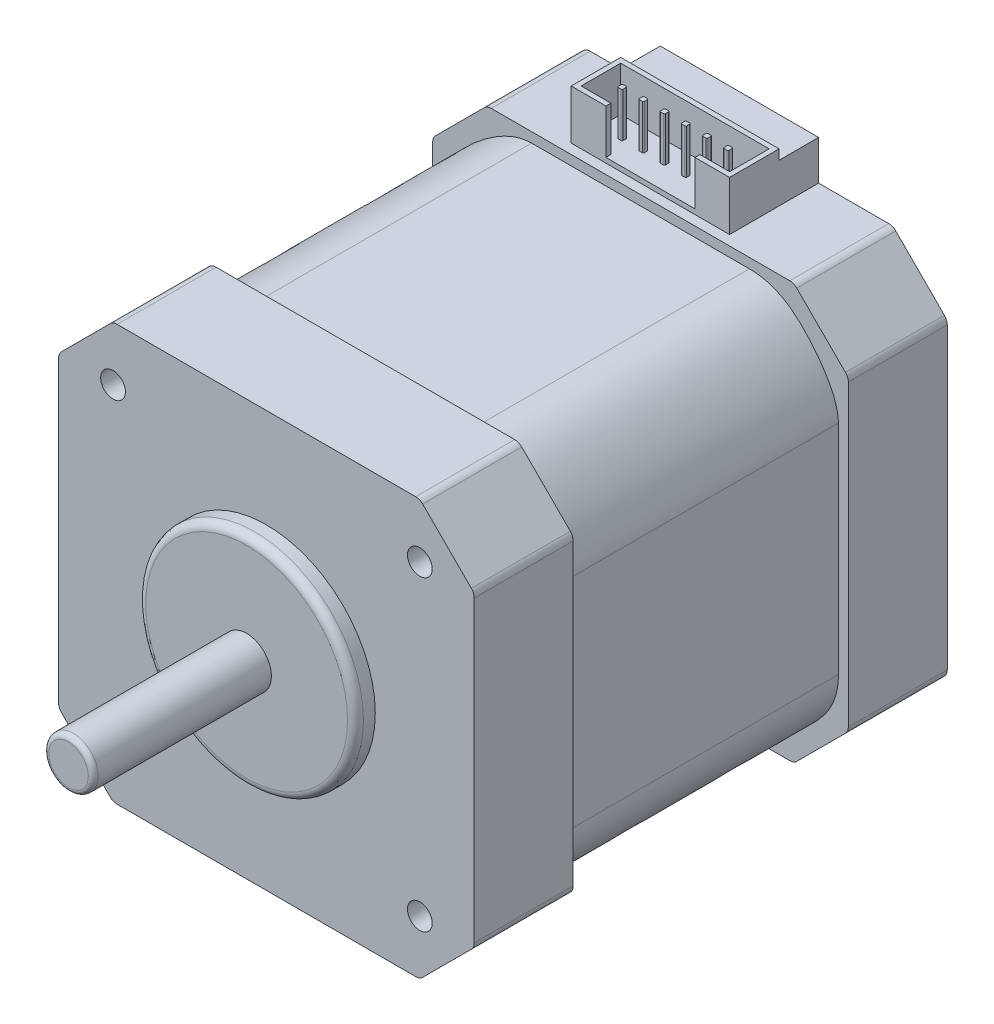
from build123d import *

# Parameters (mm, degrees)
EXTRUDE_1_DEPTH        = 10
EXTRUDE_2_DEPTH        = 27.8
EXTRUDE_3_DEPTH        = 10
SKETCH_4_R             = 11
EXTRUDE_4_DEPTH        = 2
SKETCH_5_R             = 2.5
EXTRUDE_5_DEPTH        = 18
FILLET_1_R             = 0.5
FILLET_2_R             = 0.8
FILLET_3_R             = 1
FILLET_4_R             = 1
HOLE_WIZARD_M3_4_D     = 2.5
HOLE_WIZARD_M3_4_DEPTH = 9
HOLE_WIZARD_M3_4_TIP   = 0.751075774
SKETCH_18_W            = 16
SKETCH_18_H            = 4
EXTRUDE_6_DEPTH        = 4
SKETCH_19_W            = 16
SKETCH_19_H            = 5
EXTRUDE_7_DEPTH        = 5
SKETCH_20_W            = 15
SKETCH_20_H            = 4
CUT_EXTRUDE_2_DEPTH    = 4.5
SKETCH_22_W            = 9
SKETCH_22_H            = 4.5
CUT_EXTRUDE_3_DEPTH    = 0.5
SKETCH_23_W            = 0.5
SKETCH_23_H            = 0.5
EXTRUDE_8_DEPTH        = 4.5
FILLET_6_R             = 0.1
FILLET_7_R             = 0.1
FILLET_8_R             = 0.1
FILLET_9_R             = 0.1
FILLET_10_R            = 0.1
FILLET_11_R            = 0.1


with BuildPart() as part:
    # 草图1 → 凸台-拉伸1 (new body)
    with BuildSketch(Plane.XY):
        Polygon((15.5, 21), (21, 15.5), (21, -15.5), (15.5, -21), (-15.5, -21), (-21, -15.5), (-21, 15.5), (-15.5, 21), align=None)
    extrude(amount=EXTRUDE_1_DEPTH)

    # 草图2 → 凸台-拉伸2 (add)
    with BuildSketch(Plane.XY.offset(10)):
        with BuildLine():
            Line((-11, 20), (11, 20))
            add(Edge.make_bspline(
                [(11, 20), (13.640929295, 20), (17.12066085, 17.472562842), (20, 12.937125311), (20, 11)],
                knots=[0, 0, 0, 0, 0.5, 1, 1, 1, 1], degree=3))
            Line((20, 11), (20, -11))
            add(Edge.make_bspline(
                [(20, -11), (20, -13.640929295), (17.472562842, -17.12066085), (12.937125311, -20), (11, -20)],
                knots=[0, 0, 0, 0, 0.5, 1, 1, 1, 1], degree=3))
            Line((11, -20), (-11, -20))
            add(Edge.make_bspline(
                [(-11, -20), (-13.640929295, -20), (-17.12066085, -17.472562842), (-20, -12.937125311), (-20, -11)],
                knots=[0, 0, 0, 0, 0.5, 1, 1, 1, 1], degree=3))
            Line((-20, -11), (-20, 11))
            add(Edge.make_bspline(
                [(-20, 11), (-20, 13.640929295), (-17.472562842, 17.12066085), (-12.937125311, 20), (-11, 20)],
                knots=[0, 0, 0, 0, 0.5, 1, 1, 1, 1], degree=3))
        make_face()
    extrude(amount=EXTRUDE_2_DEPTH)

    # 草图3 → 凸台-拉伸3 (add)
    with BuildSketch(Plane.XY.offset(37.8)):
        Polygon((21, -15.5), (21, 15.5), (15.5, 21), (-15.5, 21), (-21, 15.5), (-21, -15.5), (-15.5, -21), (15.5, -21), align=None)
    extrude(amount=EXTRUDE_3_DEPTH)

    # 草图4 → 凸台-拉伸4 (add)
    with BuildSketch(Plane.XY.offset(47.8)):
        Circle(SKETCH_4_R)
    extrude(amount=EXTRUDE_4_DEPTH)

    # 草图5 → 凸台-拉伸5 (add)
    with BuildSketch(Plane.XY.offset(49.8)):
        Circle(SKETCH_5_R)
    extrude(amount=EXTRUDE_5_DEPTH)

    # 圆角1
    fillet_1_edges = [part.edges().sort_by_distance(p)[0] for p in [
        (-2.5, 0, 67.8),
    ]]
    fillet(fillet_1_edges, radius=FILLET_1_R)

    # 圆角2
    fillet_2_edges = [part.edges().sort_by_distance(p)[0] for p in [
        (-11, 0, 49.8),
    ]]
    fillet(fillet_2_edges, radius=FILLET_2_R)

    # 圆角3
    fillet_3_edges = [part.edges().sort_by_distance(p)[0] for p in [
        (21, -15.5, 5),
        (15.5, -21, 5),
        (-15.5, -21, 5),
        (-21, -15.5, 5),
        (-21, 15.5, 5),
        (-15.5, 21, 5),
        (15.5, 21, 5),
        (21, 15.5, 5),
    ]]
    fillet(fillet_3_edges, radius=FILLET_3_R)

    # 圆角4
    fillet_4_edges = [part.edges().sort_by_distance(p)[0] for p in [
        (21, 15.5, 42.8),
        (15.5, 21, 42.8),
        (-15.5, 21, 42.8),
        (-21, 15.5, 42.8),
        (-21, -15.5, 42.8),
        (-15.5, -21, 42.8),
        (15.5, -21, 42.8),
        (21, -15.5, 42.8),
    ]]
    fillet(fillet_4_edges, radius=FILLET_4_R)

    # M3 螺纹孔4
    with Locations(Plane(origin=(-15.5, 15.5, 47.8), x_dir=(1, 0, 0), z_dir=(0, 0, 1))):
        with Locations((0, 0), (31, 0), (31, -31), (0, -31)):
            Hole(HOLE_WIZARD_M3_4_D / 2, depth=HOLE_WIZARD_M3_4_DEPTH)
            with Locations((0, 0, -(HOLE_WIZARD_M3_4_DEPTH + HOLE_WIZARD_M3_4_TIP / 2))):  # 118° drill point
                Cone(0, HOLE_WIZARD_M3_4_D / 2, HOLE_WIZARD_M3_4_TIP, mode=Mode.SUBTRACT)

    # 草图18 → 凸台-拉伸6 (add)
    with BuildSketch(Plane(origin=(0, 0, 0), x_dir=(-1, 0, 0), z_dir=(0, 0, -1))):
        with Locations((0, 23)):
            Rectangle(SKETCH_18_W, SKETCH_18_H)
    extrude(amount=-EXTRUDE_6_DEPTH)

    # 草图19 → 凸台-拉伸7 (add)
    with BuildSketch(Plane.XY.offset(4)):
        with Locations((0, 23.5)):
            Rectangle(SKETCH_19_W, SKETCH_19_H)
    extrude(amount=EXTRUDE_7_DEPTH)

    # 草图20 → 切除-拉伸2 (cut)
    with BuildSketch(Plane(origin=(0, 26, 0), x_dir=(1, 0, 0), z_dir=(0, 1, 0))):
        with Locations((0, -6.5)):
            Rectangle(SKETCH_20_W, SKETCH_20_H)
    extrude(amount=-CUT_EXTRUDE_2_DEPTH, mode=Mode.SUBTRACT)

    # 草图22 → 切除-拉伸3 (cut)
    with BuildSketch(Plane.XY.offset(9)):
        with Locations((0, 23.75)):
            Rectangle(SKETCH_22_W, SKETCH_22_H)
    extrude(amount=-CUT_EXTRUDE_3_DEPTH, mode=Mode.SUBTRACT)

    # 草图23 → 凸台-拉伸8 (add)
    with BuildSketch(Plane(origin=(0, 21.5, 0), x_dir=(1, 0, 0), z_dir=(0, 1, 0))):
        with Locations((-3.21, -6.5)):
            Rectangle(SKETCH_23_W, SKETCH_23_H)
        with Locations((-5.35, -6.5)):
            Rectangle(SKETCH_23_W, SKETCH_23_H)
        with Locations((-1.07, -6.5)):
            Rectangle(SKETCH_23_W, SKETCH_23_H)
        with Locations((1.07, -6.5)):
            Rectangle(SKETCH_23_W, SKETCH_23_H)
        with Locations((3.21, -6.5)):
            Rectangle(SKETCH_23_W, SKETCH_23_H)
        with Locations((5.35, -6.5)):
            Rectangle(SKETCH_23_W, SKETCH_23_H)
    extrude(amount=EXTRUDE_8_DEPTH)

    # 圆角6
    fillet_6_edges = [part.edges().sort_by_distance(p)[0] for p in [
        (-5.6, 23.75, 6.75),
        (-5.6, 23.75, 6.25),
        (-5.1, 23.75, 6.25),
        (-5.1, 23.75, 6.75),
    ]]
    fillet(fillet_6_edges, radius=FILLET_6_R)

    # 圆角7
    fillet_7_edges = [part.edges().sort_by_distance(p)[0] for p in [
        (-3.46, 23.75, 6.25),
        (-2.96, 23.75, 6.25),
        (-2.96, 23.75, 6.75),
        (-3.46, 23.75, 6.75),
    ]]
    fillet(fillet_7_edges, radius=FILLET_7_R)

    # 圆角8
    fillet_8_edges = [part.edges().sort_by_distance(p)[0] for p in [
        (-1.32, 23.75, 6.25),
        (-0.82, 23.75, 6.25),
        (-0.82, 23.75, 6.75),
        (-1.32, 23.75, 6.75),
    ]]
    fillet(fillet_8_edges, radius=FILLET_8_R)

    # 圆角9
    fillet_9_edges = [part.edges().sort_by_distance(p)[0] for p in [
        (0.82, 23.75, 6.25),
        (1.32, 23.75, 6.25),
        (1.32, 23.75, 6.75),
        (0.82, 23.75, 6.75),
    ]]
    fillet(fillet_9_edges, radius=FILLET_9_R)

    # 圆角10
    fillet_10_edges = [part.edges().sort_by_distance(p)[0] for p in [
        (2.96, 23.75, 6.25),
        (3.46, 23.75, 6.25),
        (3.46, 23.75, 6.75),
        (2.96, 23.75, 6.75),
    ]]
    fillet(fillet_10_edges, radius=FILLET_10_R)

    # 圆角11
    fillet_11_edges = [part.edges().sort_by_distance(p)[0] for p in [
        (5.1, 23.75, 6.25),
        (5.6, 23.75, 6.25),
        (5.6, 23.75, 6.75),
        (5.1, 23.75, 6.75),
    ]]
    fillet(fillet_11_edges, radius=FILLET_11_R)


solid = part.part
